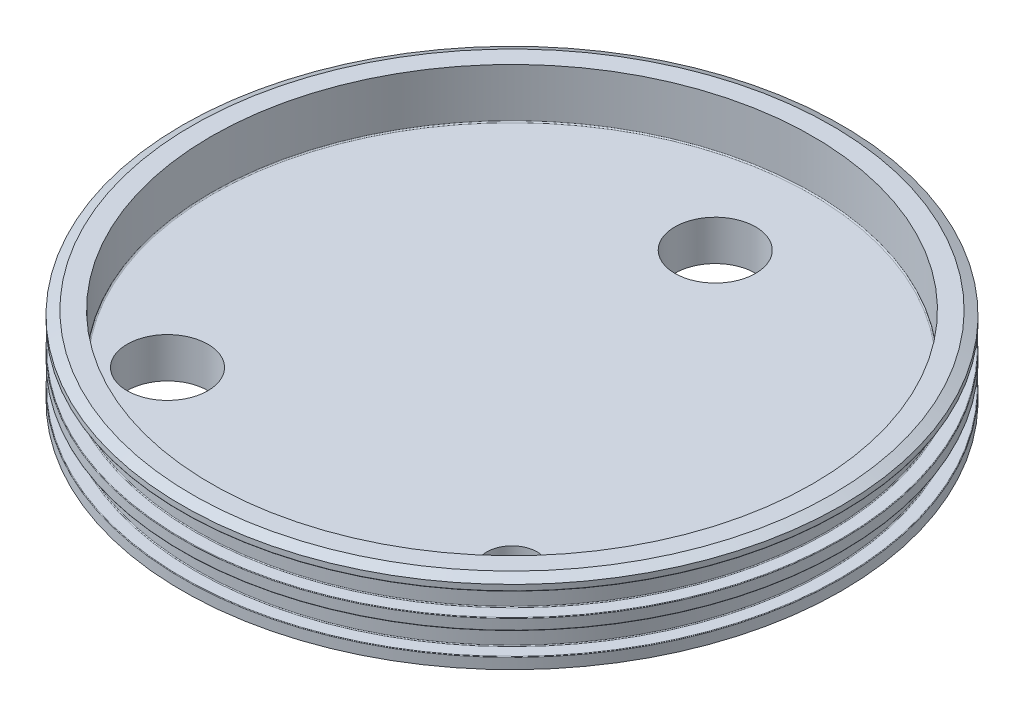
from build123d import *

# Parameters (mm, degrees)
SKETCH6_R                                = 66.04
BOSS_EXTRUDE1_DEPTH                      = 2.54
CNC_ID_FILLET_R                          = 0.1778
CNC_OD_FILLET_R                          = 0.127
CNC_CHAMFERS_SIZE                        = 1.016
CNC_CHAMFERS_SIZE2                       = 2.178819031
CNC_BORE_FILLET_R                        = 0.254
PIPE_TAP_DRILL_FOR_1_2_TAP_FILL_VALVE_D  = 17.8562
PIPE_TAP_DRILL_FOR_1_4_TAP_SOLENOID_VA_D = 11.1252
PIPE_TAP_DRILL_FOR_1_2_TAP_CRYO_VALVE_D  = 17.8562


with BuildPart() as part:
    # Sketch1 → Revolve1 (revolve)
    with BuildSketch(Plane.XY, mode=Mode.PRIVATE) as revolve1_sk:
        Polygon((0, 0), (72.898, 0), (72.898, 2.4638), (69.977, 2.4638), (69.977, 7.4422), (72.898, 7.4422), (72.898, 9.906), (69.977, 9.906), (69.977, 14.986), (72.898, 14.986), (72.898, 17.3482), (66.548, 17.3482), (66.548, 6.35), (0, 6.35), align=None)
    revolve(revolve1_sk.sketch.rotate(Axis((0, 48.192213231, 0), (0, -1, 0)), 180), axis=Axis((0, 48.192213231, 0), (0, -1, 0)))

    # Sketch6 → Boss-Extrude1 (add)
    with BuildSketch(Plane.XZ):
        Circle(SKETCH6_R)
    extrude(amount=BOSS_EXTRUDE1_DEPTH)

    # CNC ID Fillet
    cnc_id_fillet_edges = [part.edges().sort_by_distance(p)[0] for p in [
        (69.977, 14.986, 0),
        (69.977, 9.906, 0),
        (69.977, 7.4422, 0),
        (69.977, 2.4638, 0),
        (-66.04, 0, 0),
    ]]
    fillet(cnc_id_fillet_edges, radius=CNC_ID_FILLET_R)

    # CNC OD Fillet
    cnc_od_fillet_edges = [part.edges().sort_by_distance(p)[0] for p in [
        (72.898, 14.986, 0),
        (72.898, 9.906, 0),
        (72.898, 7.4422, 0),
        (72.898, 2.4638, 0),
        (-66.04, -2.54, 0),
    ]]
    fillet(cnc_od_fillet_edges, radius=CNC_OD_FILLET_R)

    # CNC Chamfers
    cnc_chamfers_edges = [part.edges().sort_by_distance(p)[0] for p in [
        (72.898, 17.3482, 0),
    ]]
    cnc_chamfers_side = [part.faces().sort_by_distance(p)[0] for p in [
        (72.898, 16.2306, 0),
    ]]
    chamfer(cnc_chamfers_edges, length=CNC_CHAMFERS_SIZE, length2=CNC_CHAMFERS_SIZE2, reference=cnc_chamfers_side[0])

    # CNC Bore Fillet
    cnc_bore_fillet_edges = [part.edges().sort_by_distance(p)[0] for p in [
        (66.548, 6.35, 0),
    ]]
    fillet(cnc_bore_fillet_edges, radius=CNC_BORE_FILLET_R)

    # Pipe Tap Drill for 1/2 Tap - Fill Valve (through all)
    with Locations(Plane(origin=(0, -2.54, 0), x_dir=(-1, 0, 0), z_dir=(0, -1, 0))):
        with Locations((0, 44.958)):
            Hole(PIPE_TAP_DRILL_FOR_1_2_TAP_FILL_VALVE_D / 2)

    # Pipe Tap Drill for 1/4 Tap - Solenoid Valve (through all)
    with Locations(Plane(origin=(0, -2.54, 0), x_dir=(-1, 0, 0), z_dir=(0, -1, 0))):
        with Locations((-38.1, -38.1)):
            Hole(PIPE_TAP_DRILL_FOR_1_4_TAP_SOLENOID_VA_D / 2)

    # Pipe Tap Drill for 1/2 Tap - Cryo Valve (through all)
    with Locations(Plane(origin=(0, -2.54, 0), x_dir=(-1, 0, 0), z_dir=(0, -1, 0))):
        with Locations((38.1, -38.1)):
            Hole(PIPE_TAP_DRILL_FOR_1_2_TAP_CRYO_VALVE_D / 2)


solid = part.part
